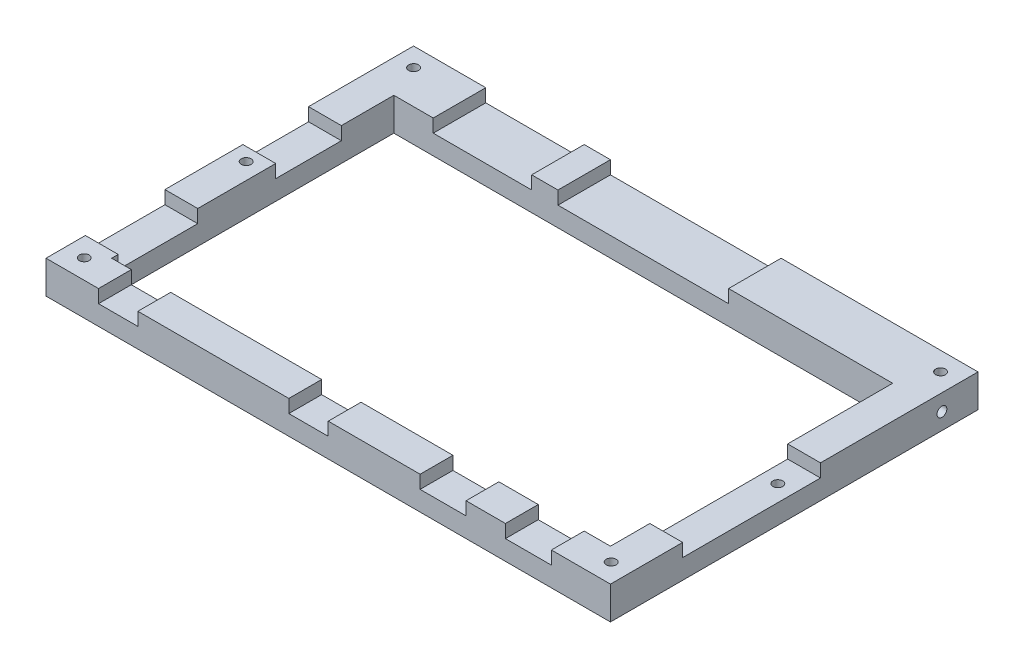
from build123d import *

# Parameters (mm, degrees)
SKETCH_1_W          = 86
SKETCH_1_H          = 174
SKETCH_1_W_2        = 50
SKETCH_1_H_2        = 25
SKETCH_1_H_3        = 55
SKETCH_1_W_3        = 76
SKETCH_1_H_4        = 43
EXTRUDE_1_DEPTH     = 5
SKETCH_4_W          = 68.7
SKETCH_4_H          = 115
SKETCH_4_W_2        = 64.7
SKETCH_4_H_2        = 37
SKETCH_4_H_3        = 70
EXTRUDE_2_DEPTH     = 10
SKETCH_5_R          = 0.75
CUT_EXTRUDE_1_DEPTH = 122.783619588
SKETCH_7_W          = 15
SKETCH_7_H          = 8
SKETCH_7_W_2        = 26
SKETCH_7_W_3        = 5
SKETCH_7_H_2        = 10
SKETCH_7_H_3        = 12.119700025
SKETCH_7_W_4        = 6
SKETCH_7_H_4        = 5
SKETCH_7_W_5        = 7
SKETCH_7_H_5        = 21
CUT_EXTRUDE_2_DEPTH = 2
SKETCH_8_R          = 0.75
CUT_EXTRUDE_3_DEPTH = 2
CUT_EXTRUDE_START   = -84
SKETCH_8_3_R        = 0.75
CUT_EXTRUDE_4_DEPTH = 2
SKETCH_9_W          = 86
SKETCH_9_H          = 118
SKETCH_9_R          = 0.75
SKETCH_9_W_2        = 50
SKETCH_9_H_2        = 55
SKETCH_9_H_3        = 25
CUT_EXTRUDE_5_DEPTH = 123.295748086


with BuildPart() as part:
    # 草图1 → 凸台-拉伸1 (new body)
    with BuildSketch(Plane(origin=(0, 0, 0), x_dir=(1, 0, 0), z_dir=(0, 1, 0))):
        with Locations((0, -26.5)):
            Rectangle(SKETCH_1_W, SKETCH_1_H)
        with Locations((0, -38)):
            Rectangle(SKETCH_1_W_2, SKETCH_1_H_2, mode=Mode.SUBTRACT)
        with Locations((0, 23)):
            Rectangle(SKETCH_1_W_2, SKETCH_1_H_3, mode=Mode.SUBTRACT)
        with Locations((0, -87)):
            Rectangle(SKETCH_1_W_3, SKETCH_1_H_4, mode=Mode.SUBTRACT)
    extrude(amount=EXTRUDE_1_DEPTH)

    # 草图4 → 凸台-拉伸2 (add)
    with BuildSketch(Plane(origin=(0, 5, 0), x_dir=(1, 0, 0), z_dir=(0, 1, 0))):
        Rectangle(SKETCH_4_W, SKETCH_4_H)
        with Locations((0, -37)):
            Rectangle(SKETCH_4_W_2, SKETCH_4_H_2, mode=Mode.SUBTRACT)
        with Locations((0, 20.5)):
            Rectangle(SKETCH_4_W_2, SKETCH_4_H_3, mode=Mode.SUBTRACT)
    extrude(amount=EXTRUDE_2_DEPTH)

    # 草图5 → 切除-拉伸1 (cut, through all)
    with BuildSketch(Plane(origin=(0, 5, 0), x_dir=(1, 0, 0), z_dir=(0, 1, 0))):
        with Locations(Location((-39, 20.5, 0), (0, 0, 270))):
            Circle(SKETCH_5_R)
        with Locations(Location((39, 20.5, 0), (0, 0, 270))):
            Circle(SKETCH_5_R)
        with Locations(Location((-39, -32.5, 0), (0, 0, 270))):
            Circle(SKETCH_5_R)
        with Locations(Location((39, -32.5, 0), (0, 0, 270))):
            Circle(SKETCH_5_R)
        with Locations(Location((-40.1427775, -60.35, 0), (0, 0, 270))):
            Circle(SKETCH_5_R)
        with Locations(Location((40.1427775, -60.35, 0), (0, 0, 270))):
            Circle(SKETCH_5_R)
        with Locations(Location((-40.1427775, -110.530299975, 0), (0, 0, 270))):
            Circle(SKETCH_5_R)
        with Locations(Location((40.1427775, -110.530299975, 0), (0, 0, 270))):
            Circle(SKETCH_5_R)
        with Locations(Location((-40.5, 57.5, 0), (0, 0, 270))):
            Circle(SKETCH_5_R)
        with Locations(Location((-40.5, -38, 0), (0, 0, 270))):
            Circle(SKETCH_5_R)
        with Locations(Location((-40.5, -85.5, 0), (0, 0, 270))):
            Circle(SKETCH_5_R)
        with Locations(Location((40.5, 57.5, 0), (0, 0, 270))):
            Circle(SKETCH_5_R)
        with Locations(Location((40.5, -38, 0), (0, 0, 270))):
            Circle(SKETCH_5_R)
        with Locations(Location((40.5, -85.5, 0), (0, 0, 270))):
            Circle(SKETCH_5_R)
        with Locations(Location((-40.5, -4.5, 0), (0, 0, 270))):
            Circle(SKETCH_5_R)
        with Locations(Location((40.5, -4.5, 0), (0, 0, 270))):
            Circle(SKETCH_5_R)
    extrude(amount=-CUT_EXTRUDE_1_DEPTH, mode=Mode.SUBTRACT)

    # 草图7 → 切除-拉伸2 (cut)
    with BuildSketch(Plane(origin=(0, 5, 0), x_dir=(1, 0, 0), z_dir=(0, 1, 0))):
        with Locations((-24.5, -61.5)):
            Rectangle(SKETCH_7_W, SKETCH_7_H)
        with Locations((0, -61.5)):
            Rectangle(SKETCH_7_W_2, SKETCH_7_H)
        with Locations((-40.5, -78.5)):
            Rectangle(SKETCH_7_W_3, SKETCH_7_H_2)
        with Locations((-40.5, -101.440149988)):
            Rectangle(SKETCH_7_W_3, SKETCH_7_H_3)
        with Locations((-32, -111)):
            Rectangle(SKETCH_7_W_4, SKETCH_7_H_4)
        with Locations((-3, -111)):
            Rectangle(SKETCH_7_W_4, SKETCH_7_H_4)
        with Locations((17.5, -111)):
            Rectangle(SKETCH_7_W_5, SKETCH_7_H_4)
        with Locations((30.5, -111)):
            Rectangle(SKETCH_7_W_5, SKETCH_7_H_4)
        with Locations((40.5, -92)):
            Rectangle(SKETCH_7_W_3, SKETCH_7_H_5)
    extrude(amount=-CUT_EXTRUDE_2_DEPTH, mode=Mode.SUBTRACT)

    # 草图8 → 切除-拉伸3 (cut)
    with BuildSketch(Plane.ZY.offset(43)):
        with Locations((8, 2.5)):
            Circle(SKETCH_8_R)
        with Locations((23, 2.5)):
            Circle(SKETCH_8_R)
        with Locations((52, 2.5)):
            Circle(SKETCH_8_R)
        with Locations((63, 2.5)):
            Circle(SKETCH_8_R)
    extrude(amount=-CUT_EXTRUDE_3_DEPTH, mode=Mode.SUBTRACT)

    # 草图8<3> → 切除-拉伸4 (cut)
    with BuildSketch(Plane.ZY.offset(43).offset(CUT_EXTRUDE_START)):
        with Locations((8, 2.5)):
            Circle(SKETCH_8_3_R)
        with Locations((23, 2.5)):
            Circle(SKETCH_8_3_R)
        with Locations((52, 2.5)):
            Circle(SKETCH_8_3_R)
        with Locations((63, 2.5)):
            Circle(SKETCH_8_3_R)
    extrude(amount=-CUT_EXTRUDE_4_DEPTH, mode=Mode.SUBTRACT)

    # 草图9 → 切除-拉伸5 (cut, through all)
    with BuildSketch(Plane(origin=(0, 0, 0), x_dir=(1, 0, 0), z_dir=(0, 1, 0))):
        with Locations((0, 1.5)):
            Rectangle(SKETCH_9_W, SKETCH_9_H)
        with Locations((-40.5, -4.5)):
            Circle(SKETCH_9_R, mode=Mode.SUBTRACT)
        with Locations((-39, 20.5)):
            Circle(SKETCH_9_R, mode=Mode.SUBTRACT)
        with Locations((-40.5, 57.5)):
            Circle(SKETCH_9_R, mode=Mode.SUBTRACT)
        with Locations((0, 23)):
            Rectangle(SKETCH_9_W_2, SKETCH_9_H_2, mode=Mode.SUBTRACT)
        with Locations((40.5, -4.5)):
            Circle(SKETCH_9_R, mode=Mode.SUBTRACT)
        with Locations((39, 20.5)):
            Circle(SKETCH_9_R, mode=Mode.SUBTRACT)
        with Locations((40.5, 57.5)):
            Circle(SKETCH_9_R, mode=Mode.SUBTRACT)
        with Locations((39, -32.5)):
            Circle(SKETCH_9_R, mode=Mode.SUBTRACT)
        with Locations((-40.5, -38)):
            Circle(SKETCH_9_R, mode=Mode.SUBTRACT)
        with Locations((-39, -32.5)):
            Circle(SKETCH_9_R, mode=Mode.SUBTRACT)
        with Locations((0, -38)):
            Rectangle(SKETCH_9_W_2, SKETCH_9_H_3, mode=Mode.SUBTRACT)
        with Locations((40.5, -38)):
            Circle(SKETCH_9_R, mode=Mode.SUBTRACT)
    extrude(amount=CUT_EXTRUDE_5_DEPTH, mode=Mode.SUBTRACT)


solid = part.part
